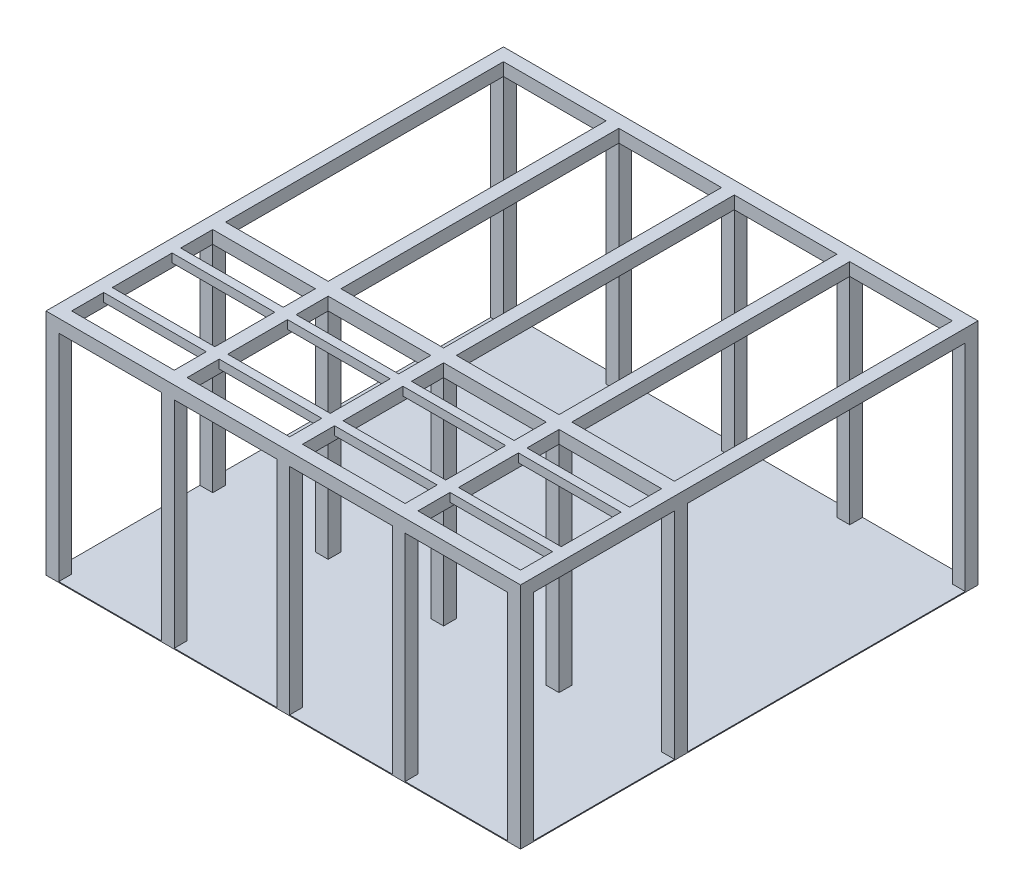
from build123d import *

# Parameters (mm, degrees)
SKETCH_1_W                  = 5550
SKETCH_1_H                  = 5350
EXTRUDE_1_DEPTH             = 10
SKETCH_2_W                  = 150
SKETCH_2_H                  = 150
EXTRUDE_2_DEPTH             = 2516
PATTERN_LINEAR_1_COUNT      = 5
PATTERN_LINEAR_1_PITCH      = 1350
PATTERN_LINEAR_1_COUNT_DIR2 = 2
PATTERN_LINEAR_1_PITCH_DIR2 = 1800
SKETCH_3_W                  = 150
SKETCH_3_H                  = 150
EXTRUDE_3_DEPTH             = 2516
PATTERN_LINEAR_2_COUNT      = 5
PATTERN_LINEAR_2_PITCH      = 1350
SKETCH_4_W                  = 150
SKETCH_4_H                  = 150
EXTRUDE_4_DEPTH             = 5550
PATTERN_LINEAR_3_COUNT      = 2
PATTERN_LINEAR_3_PITCH      = 1800
SKETCH_5_W                  = 150
SKETCH_5_H                  = 150
EXTRUDE_5_DEPTH             = 5350
PATTERN_LINEAR_4_COUNT      = 5
PATTERN_LINEAR_4_PITCH      = 1350
PATTERN_LINEAR_5_COUNT      = 2
PATTERN_LINEAR_5_PITCH      = 5200
EXTRUDE_6_REACH             = 8060.752
SKETCH_6_W                  = 100
SKETCH_6_H                  = 100
PATTERN_LINEAR_6_COUNT      = 2
PATTERN_LINEAR_6_PITCH      = 800


with BuildPart() as part:
    # 草图1 → 凸台-拉伸1 (new body)
    with BuildSketch(Plane(origin=(0, 0, 0), x_dir=(1, 0, 0), z_dir=(0, 1, 0))):
        with Locations((2775, 2675)):
            Rectangle(SKETCH_1_W, SKETCH_1_H)
    extrude(amount=EXTRUDE_1_DEPTH)

    # 草图2 → 凸台-拉伸2 (add)
    with BuildSketch(Plane(origin=(0, 10, 0), x_dir=(1, 0, 0), z_dir=(0, 1, 0))):
        with Locations((75, 75)):
            Rectangle(SKETCH_2_W, SKETCH_2_H)
    extrude_2 = extrude(amount=EXTRUDE_2_DEPTH)

    # 阵列(线性)1: Extrude 2 5 × 2
    with Locations(*[(i * PATTERN_LINEAR_1_PITCH, 0, -j * PATTERN_LINEAR_1_PITCH_DIR2) for i in range(PATTERN_LINEAR_1_COUNT) for j in range(PATTERN_LINEAR_1_COUNT_DIR2) if (i, j) != (0, 0)]):
        add(extrude_2)

    # 草图3 → 凸台-拉伸3 (add)
    with BuildSketch(Plane(origin=(0, 10, 0), x_dir=(1, 0, 0), z_dir=(0, 1, 0))):
        with Locations((75, 5275)):
            Rectangle(SKETCH_3_W, SKETCH_3_H)
    extrude_3 = extrude(amount=EXTRUDE_3_DEPTH)

    # 阵列(线性)2: 凸台-拉伸3 ×5
    with Locations(*[(i * PATTERN_LINEAR_2_PITCH, 0, 0) for i in range(1, PATTERN_LINEAR_2_COUNT)]):
        add(extrude_3)

    # 草图4 → 凸台-拉伸4 (add)
    with BuildSketch(Plane(origin=(5550, 0, 0), x_dir=(0, 0, -1), z_dir=(1, 0, 0))):
        with Locations((75, 2601)):
            Rectangle(SKETCH_4_W, SKETCH_4_H)
    extrude_4 = extrude(amount=-EXTRUDE_4_DEPTH)

    # 阵列(线性)3: 凸台-拉伸4 ×2
    with Locations(*[(0, 0, -i * PATTERN_LINEAR_3_PITCH) for i in range(1, PATTERN_LINEAR_3_COUNT)]):
        add(extrude_4)

    # 草图5 → 凸台-拉伸5 (add)
    with BuildSketch(Plane.XY):
        with Locations((75, 2601)):
            Rectangle(SKETCH_5_W, SKETCH_5_H)
    extrude_5 = extrude(amount=-EXTRUDE_5_DEPTH)

    # 阵列(线性)4: 凸台-拉伸5 ×5
    with Locations(*[(i * PATTERN_LINEAR_4_PITCH, 0, 0) for i in range(1, PATTERN_LINEAR_4_COUNT)]):
        add(extrude_5)

    # 阵列(线性)5: 凸台-拉伸4 ×2
    with Locations(*[(0, 0, -i * PATTERN_LINEAR_5_PITCH) for i in range(1, PATTERN_LINEAR_5_COUNT)]):
        add(extrude_4)

    # 凸台-拉伸6: up to this face of the body (flat: up to its plane)
    extrude_6_end = Plane(part.part.faces().sort_by_distance((5400, 2601, -975))[0])
    # 草图6 → 凸台-拉伸6 (add, up to the picked face)
    with BuildSketch(Plane(origin=(150, 0, 0), x_dir=(0, 0, -1), z_dir=(1, 0, 0)), mode=Mode.PRIVATE) as extrude_6_sk1:
        with Locations((575, 2626)):
            Rectangle(SKETCH_6_W, SKETCH_6_H)
    extrude_6_tool1 = split(extrude(extrude_6_sk1.sketch, amount=EXTRUDE_6_REACH, mode=Mode.PRIVATE), bisect_by=extrude_6_end, keep=Keep.BOTH, mode=Mode.PRIVATE)
    extrude_6 = extrude_6_tool1.solids().sort_by(Axis((150, 2626, -575), (1, 0, 0)))[0]
    add(extrude_6)

    # 阵列(线性)6: 凸台-拉伸6 ×2
    with Locations(*[(0, 0, -i * PATTERN_LINEAR_6_PITCH) for i in range(1, PATTERN_LINEAR_6_COUNT)]):
        add(extrude_6)


solid = part.part
